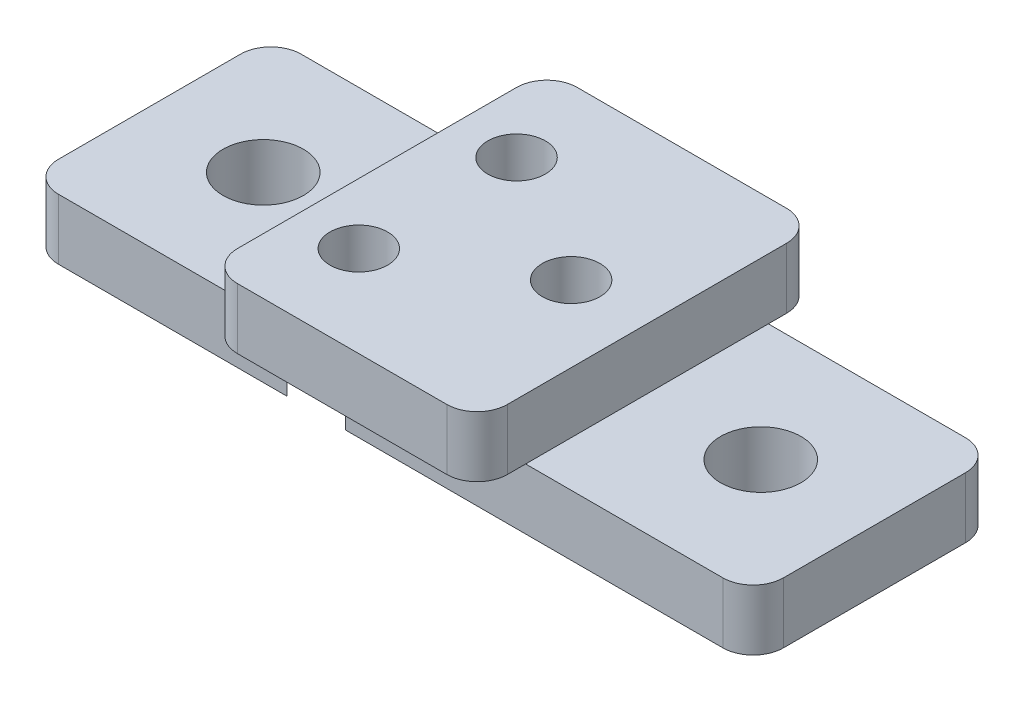
from build123d import *

# Parameters (mm, degrees)
SKETCH1_W           = 47.8
SKETCH1_H           = 16
BOSS_EXTRUDE1_DEPTH = 4
SKETCH2_W           = 17.8
SKETCH2_H           = 22.4
SKETCH2_R           = 1.9
BOSS_EXTRUDE2_DEPTH = 4
SKETCH3_R           = 3.4
CUT_EXTRUDE1_DEPTH  = 4
SKETCH4_R           = 2.65
CUT_EXTRUDE2_DEPTH  = 4
FILLET1_R           = 2


with BuildPart() as part:
    # Sketch1 → Boss-Extrude1 (new body)
    with BuildSketch(Plane(origin=(0, 0, 0), x_dir=(1, 0, 0), z_dir=(0, 1, 0))):
        with Locations((23.9, 8)):
            Rectangle(SKETCH1_W, SKETCH1_H)
    extrude(amount=BOSS_EXTRUDE1_DEPTH)

    # Sketch2 → Boss-Extrude2 (add)
    with BuildSketch(Plane(origin=(0, 4, 0), x_dir=(1, 0, 0), z_dir=(0, 1, 0))):
        with Locations((23.9, 8)):
            Rectangle(SKETCH2_W, SKETCH2_H)
        with Locations(Location((19, 13.2, 0), (0, 0, 270))):
            Circle(SKETCH2_R, mode=Mode.SUBTRACT)
        with Locations(Location((27.8, 8, 0), (0, 0, 270))):
            Circle(SKETCH2_R, mode=Mode.SUBTRACT)
        with Locations(Location((19, 2.8, 0), (0, 0, 270))):
            Circle(SKETCH2_R, mode=Mode.SUBTRACT)
    extrude(amount=BOSS_EXTRUDE2_DEPTH)

    # Sketch3 → Cut-Extrude1 (cut)
    with BuildSketch(Plane.XZ):
        with Locations((19, -2.8)):
            Circle(SKETCH3_R)
        with Locations(Location((27.8, -8, 0), (0, 0, 270))):
            Circle(SKETCH3_R)
        with Locations((19, -13.2)):
            Circle(SKETCH3_R)
    extrude(amount=-CUT_EXTRUDE1_DEPTH, mode=Mode.SUBTRACT)

    # Sketch4 → Cut-Extrude2 (cut)
    with BuildSketch(Plane(origin=(0, 4, 0), x_dir=(1, 0, 0), z_dir=(0, 1, 0))):
        with Locations(Location((7.5, 8, 0), (0, 0, 270))):
            Circle(SKETCH4_R)
        with Locations(Location((40.3, 8, 0), (0, 0, 270))):
            Circle(SKETCH4_R)
    extrude(amount=-CUT_EXTRUDE2_DEPTH, mode=Mode.SUBTRACT)

    # Fillet1
    fillet1_edges = [part.edges().sort_by_distance(p)[0] for p in [
        (15, 6, -19.2),
        (15, 6, 3.2),
        (32.8, 6, 3.2),
        (32.8, 6, -19.2),
        (0, 2, -16),
        (47.8, 2, -16),
        (47.8, 2, 0),
        (0, 2, 0),
    ]]
    fillet(fillet1_edges, radius=FILLET1_R)


solid = part.part
